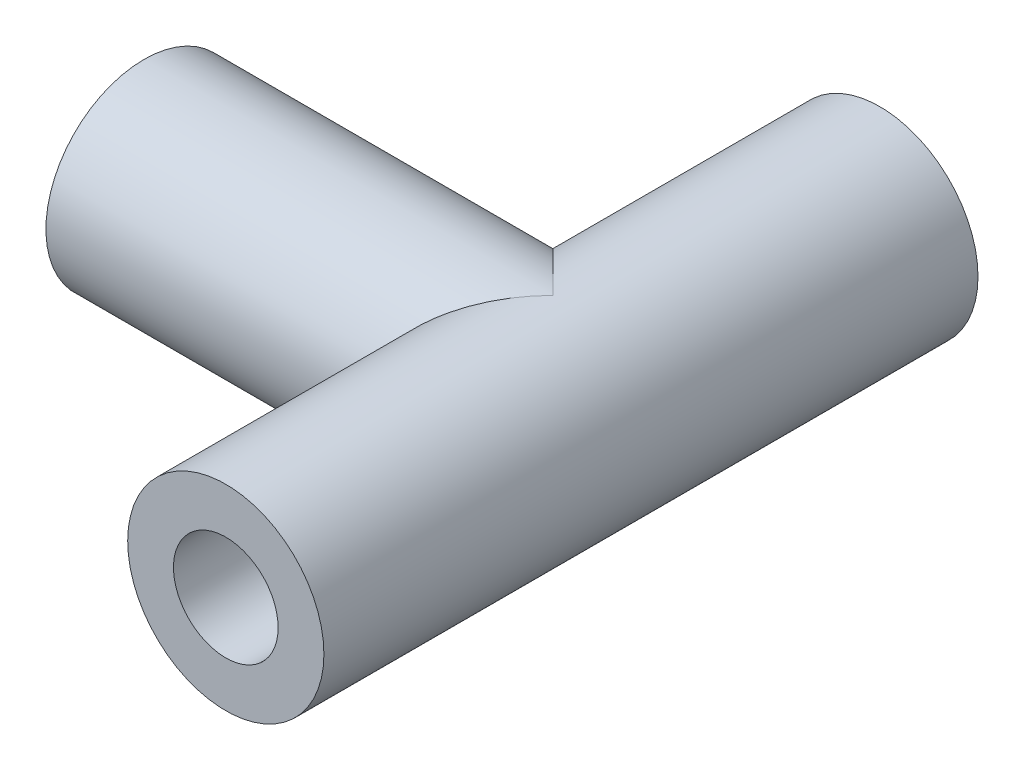
from build123d import *

# Parameters (mm, degrees)
BRANCH_HUB_START       = -13
SKETCH1_R              = 6
BRANCH_HUB_DEPTH       = 13
RUN_BACK_PORT_START    = -20
SKETCH2_R              = 6
RUN_BACK_PORT_DEPTH    = 12
RUN_BACK_SOCKET_START  = -20
SKETCH3_R              = 3.2
RUN_BACK_SOCKET_DEPTH  = 10
RUN_FRONT_PORT_START   = 8
SKETCH4_R              = 6
RUN_FRONT_PORT_DEPTH   = 12
RUN_FRONT_SOCKET_START = 20
SKETCH5_R              = 3.2
RUN_FRONT_SOCKET_DEPTH = 10
RUN_HUB_START          = -8
SKETCH6_R              = 6
RUN_HUB_DEPTH          = 16
BRANCH_PORT_START      = -25
SKETCH7_R              = 6
BRANCH_PORT_DEPTH      = 12
BRANCH_SOCKET_START    = -25
SKETCH8_R              = 3.2
BRANCH_SOCKET_DEPTH    = 10


with BuildPart() as part:
    # Sketch1 → Branch_Hub (new body)
    with BuildSketch(Plane(origin=(0, 0, 0), x_dir=(0, 0, -1), z_dir=(1, 0, 0)).offset(BRANCH_HUB_START)):
        Circle(SKETCH1_R)
    extrude(amount=BRANCH_HUB_DEPTH)



with BuildPart() as body_2:
    # Sketch2 → Run_Back_Port (new body)
    with BuildSketch(Plane.XY.offset(RUN_BACK_PORT_START)):
        Circle(SKETCH2_R)
    extrude(amount=RUN_BACK_PORT_DEPTH)

    # Sketch3 → Run_Back_Socket (cut)
    with BuildSketch(Plane.XY.offset(RUN_BACK_SOCKET_START)):
        Circle(SKETCH3_R)
    extrude(amount=RUN_BACK_SOCKET_DEPTH, mode=Mode.SUBTRACT)


with BuildPart() as body_3:
    # Sketch4 → Run_Front_Port (new body)
    with BuildSketch(Plane.XY.offset(RUN_FRONT_PORT_START)):
        Circle(SKETCH4_R)
    extrude(amount=RUN_FRONT_PORT_DEPTH)

    # Sketch5 → Run_Front_Socket (cut)
    with BuildSketch(Plane.XY.offset(RUN_FRONT_SOCKET_START)):
        Circle(SKETCH5_R)
    extrude(amount=-RUN_FRONT_SOCKET_DEPTH, mode=Mode.SUBTRACT)


with BuildPart() as part_1:
    add(part.part)

    add(body_2.part)  # Run_Hub merges body 2

    add(body_3.part)  # Run_Hub merges body 3
    # Sketch6 → Run_Hub (add)
    with BuildSketch(Plane.XY.offset(RUN_HUB_START)):
        Circle(SKETCH6_R)
    extrude(amount=RUN_HUB_DEPTH)

    # Sketch7 → Branch_Port (add)
    with BuildSketch(Plane(origin=(0, 0, 0), x_dir=(0, 0, -1), z_dir=(1, 0, 0)).offset(BRANCH_PORT_START)):
        with Locations(Location((0, 0, 0), (0, 0, 90))):
            Circle(SKETCH7_R)
    extrude(amount=BRANCH_PORT_DEPTH)

    # Sketch8 → Branch_Socket (cut)
    with BuildSketch(Plane(origin=(0, 0, 0), x_dir=(0, 0, -1), z_dir=(1, 0, 0)).offset(BRANCH_SOCKET_START)):
        Circle(SKETCH8_R)
    extrude(amount=BRANCH_SOCKET_DEPTH, mode=Mode.SUBTRACT)


solid = part_1.part
